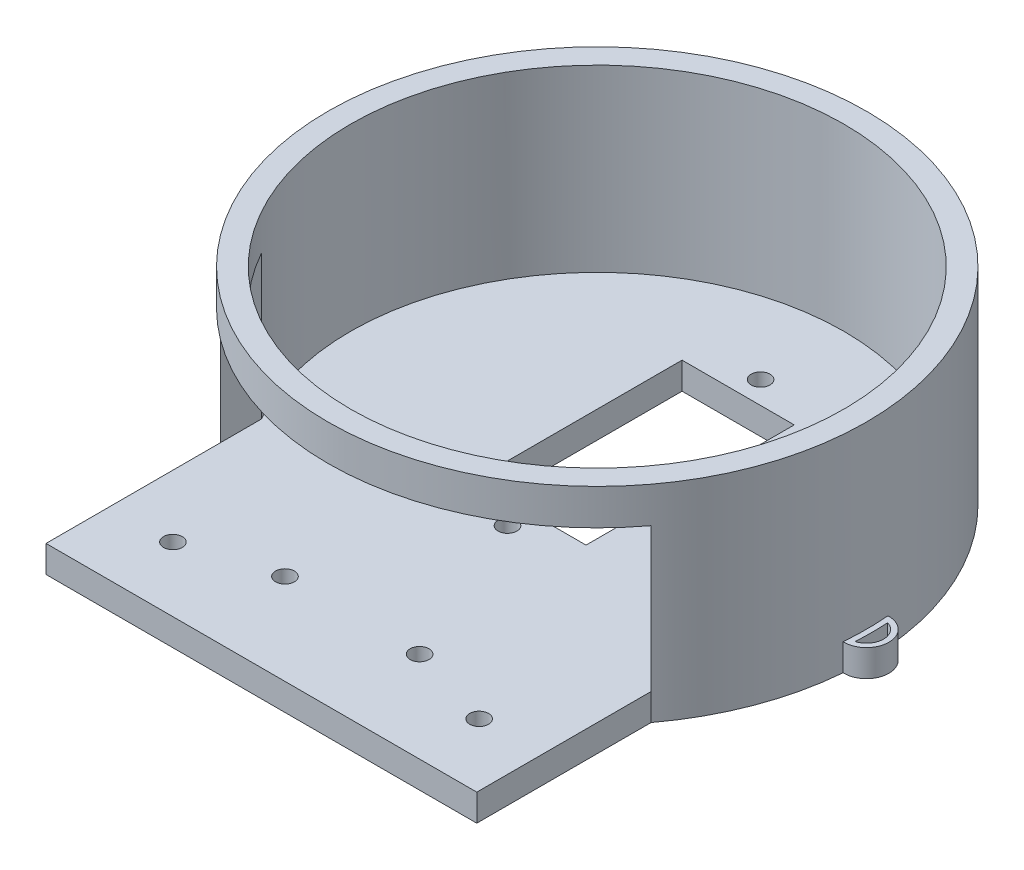
from build123d import *

# Parameters (mm, degrees)
SKETCH1_W           = 12.5
SKETCH1_H           = 23.2
BOSS_EXTRUDE1_DEPTH = 3
SKETCH4_R           = 30
SKETCH4_R_2         = 27.5
BOSS_EXTRUDE3_DEPTH = 20
SKETCH5_R           = 1.05
CUT_EXTRUDE2_DEPTH  = 51.124844139
BOSS_EXTRUDE4_DEPTH = 3
CUT_EXTRUDE11_START = -8.575715
SKETCH9_W           = 48
SKETCH9_H           = 16
CUT_EXTRUDE11_DEPTH = 16.574279
CUT_EXTRUDE12_DEPTH = 52.393398578
BOSS_EXTRUDE8_START = -3
BOSS_EXTRUDE8_DEPTH = 3
SKETCH10_R          = 1.05
CUT_EXTRUDE13_DEPTH = 54.449294936


with BuildPart() as part:
    # Sketch1 → Boss-Extrude1 (new body)
    with BuildSketch(Plane(origin=(0, 0, 0), x_dir=(1, 0, 0), z_dir=(0, 1, 0))):
        with BuildLine():
            ThreePointArc((-29.895833333, -2.497828918), (0, -30), (29.895833333, -2.497828918))
            ThreePointArc((29.895833333, -2.497828918), (32.5, 0), (29.895833333, 2.497828918))
            ThreePointArc((29.895833333, 2.497828918), (21.213203436, 21.213203436), (2.497828918, 29.895833333))
            ThreePointArc((2.497828918, 29.895833333), (0, 32.5), (-2.497828918, 29.895833333))
            ThreePointArc((-2.497828918, 29.895833333), (-21.213203436, 21.213203436), (-29.895833333, 2.497828918))
            ThreePointArc((-29.895833333, 2.497828918), (-32.5, 0), (-29.895833333, -2.497828918))
        make_face()
        with Locations((0, 4.1)):
            Rectangle(SKETCH1_W, SKETCH1_H, mode=Mode.SUBTRACT)
    extrude(amount=BOSS_EXTRUDE1_DEPTH)

    # Sketch4 → Boss-Extrude3 (add)
    with BuildSketch(Plane(origin=(0, 3, 0), x_dir=(1, 0, 0), z_dir=(0, 1, 0))):
        with Locations(Location((0, 0, 0), (0, 0, 85.223969073))):
            Circle(SKETCH4_R)
        with Locations(Location((0, 0, 0), (0, 0, 270))):
            Circle(SKETCH4_R_2, mode=Mode.SUBTRACT)
    extrude(amount=BOSS_EXTRUDE3_DEPTH)

    # Sketch5 → Cut-Extrude2 (cut, through all)
    with BuildSketch(Plane(origin=(0, 3, 0), x_dir=(1, 0, 0), z_dir=(0, 1, 0))):
        with Locations(Location((0, 18.2, 0), (0, 0, 270))):
            Circle(SKETCH5_R)
        with Locations(Location((0, -10, 0), (0, 0, 270))):
            Circle(SKETCH5_R)
    extrude(amount=-CUT_EXTRUDE2_DEPTH, mode=Mode.SUBTRACT)

    # Sketch6 → Boss-Extrude4 (add)
    with BuildSketch(Plane(origin=(0, 0, 0), x_dir=(1, 0, 0), z_dir=(0, 1, 0))):
        with BuildLine():
            Line((-21, -21.424285286), (-21, -34.424285286))
            Line((-21, -34.424285286), (21, -34.424285286))
            Line((21, -34.424285286), (21, -21.424285286))
            ThreePointArc((21, -21.424285286), (0, -30), (-21, -21.424285286))
        make_face()
    extrude(amount=BOSS_EXTRUDE4_DEPTH)

    # Sketch9 → Cut-Extrude11 (cut)
    with BuildSketch(Plane(origin=(0, 0, 21.424285286), x_dir=(-1, 0, 0), z_dir=(0, 0, -1)).offset(CUT_EXTRUDE11_START)):
        with Locations((0, 11)):
            Rectangle(SKETCH9_W, SKETCH9_H)
    extrude(amount=CUT_EXTRUDE11_DEPTH, mode=Mode.SUBTRACT)

    # Sketch12 → Cut-Extrude12 (cut, through all)
    with BuildSketch(Plane(origin=(0, 3, 0), x_dir=(1, 0, 0), z_dir=(0, 1, 0))):
        with BuildLine():
            ThreePointArc((1.819908232, 30.545833333), (0, 30.6), (-1.819908232, 30.545833333))
            ThreePointArc((-1.819908232, 30.545833333), (0, 31.9), (1.819908232, 30.545833333))
        make_face()
        with BuildLine():
            ThreePointArc((30.545833333, -1.819908232), (30.6, 0), (30.545833333, 1.819908232))
            ThreePointArc((30.545833333, 1.819908232), (31.9, 0), (30.545833333, -1.819908232))
        make_face()
        with BuildLine():
            ThreePointArc((-30.545833333, 1.819908232), (-30.6, 0), (-30.545833333, -1.819908232))
            ThreePointArc((-30.545833333, -1.819908232), (-31.9, 0), (-30.545833333, 1.819908232))
        make_face()
    extrude(amount=-CUT_EXTRUDE12_DEPTH, mode=Mode.SUBTRACT)

    # Sketch13 → Boss-Extrude8 (add)
    with BuildSketch(Plane(origin=(0, 3, 0), x_dir=(1, 0, 0), z_dir=(0, 1, 0)).offset(BOSS_EXTRUDE8_START)):
        with BuildLine():
            Line((21, -34.424285286), (21, -21.424285286))
            ThreePointArc((21, -21.424285286), (22.565048913, -19.769131685), (24, -18))
            Line((24, -18), (24, -37.424285286))
            Line((24, -37.424285286), (-24, -37.424285286))
            Line((-24, -37.424285286), (-24, -18))
            ThreePointArc((-24, -18), (-22.565048913, -19.769131685), (-21, -21.424285286))
            Line((-21, -21.424285286), (-21, -34.424285286))
            Line((-21, -34.424285286), (21, -34.424285286))
        make_face()
    extrude(amount=BOSS_EXTRUDE8_DEPTH)

    # Sketch10 → Cut-Extrude13 (cut, through all)
    with BuildSketch(Plane(origin=(0, 3, 0), x_dir=(1, 0, 0), z_dir=(0, 1, 0))):
        with Locations(Location((-7.5, -27.296921086, 0), (0, 0, 270))):
            Circle(SKETCH10_R)
        with Locations(Location((-17.06304756, -30.220638133, 0), (0, 0, 270))):
            Circle(SKETCH10_R)
        with Locations(Location((7.5, -27.296921086, 0), (0, 0, 270))):
            Circle(SKETCH10_R)
        with Locations(Location((17.06304756, -30.220638133, 0), (0, 0, 270))):
            Circle(SKETCH10_R)
    extrude(amount=-CUT_EXTRUDE13_DEPTH, mode=Mode.SUBTRACT)


solid = part.part
